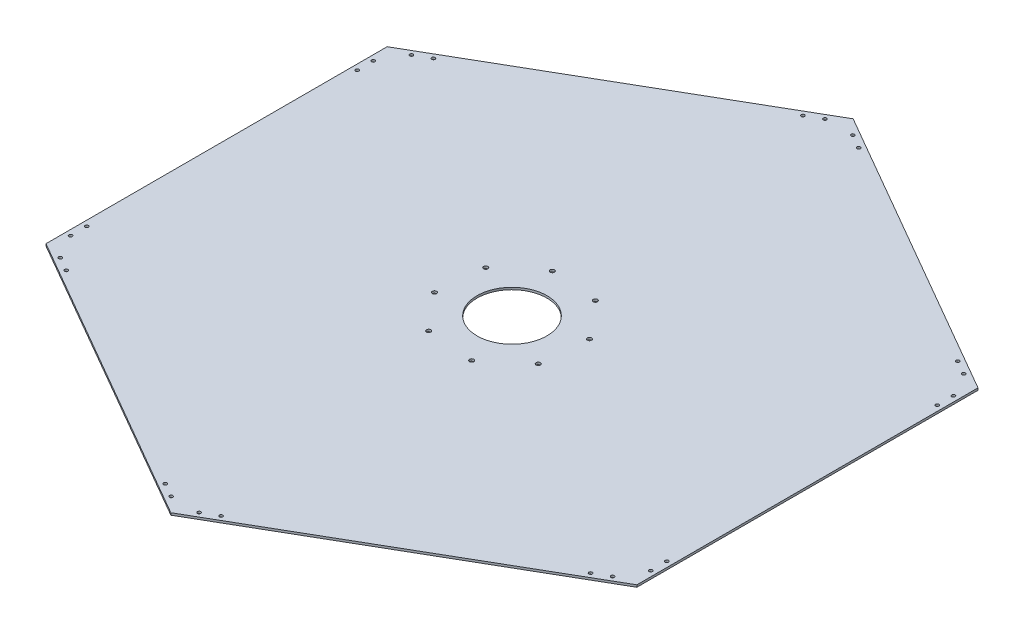
from build123d import *

# Parameters (mm, degrees)
BOSS_EXTRUDE1_DEPTH = 4
CUT_EXTRUDE1_REACH  = 842.148
SKETCH3_R           = 4
CUT_EXTRUDE2_REACH  = 842.148
SKETCH4_R           = 3.1
CIRPATTERN1_COUNT   = 6
CUT_EXTRUDE3_REACH  = 842.148
SKETCH5_R           = 65


with BuildPart() as part:
    # Sketch1 → Boss-Extrude1 (new body)
    with BuildSketch(Plane(origin=(0, 0, 0), x_dir=(1, 0, 0), z_dir=(0, 1, 0))):
        Polygon((0, 635.085296109), (-550, 317.542648054), (-550, -317.542648054), (0, -635.085296109), (550, -317.542648054), (550, 317.542648054), align=None)
    extrude(amount=BOSS_EXTRUDE1_DEPTH)

    # Sketch3 → Cut-Extrude1 (cut, up to next)
    with BuildSketch(Plane(origin=(0, 4, 0), x_dir=(1, 0, 0), z_dir=(0, 1, 0)), mode=Mode.PRIVATE) as cut_extrude1_sk1:
        with Locations(Location((53.101090522, 102.006245815, 0), (0, 0, 270))):
            Circle(SKETCH3_R)
    cut_extrude1_tool1 = extrude(cut_extrude1_sk1.sketch, amount=-CUT_EXTRUDE1_REACH, mode=Mode.PRIVATE) & part.part
    # Sketch3 → Cut-Extrude1 (cut, up to next)
    with BuildSketch(Plane(origin=(0, 4, 0), x_dir=(1, 0, 0), z_dir=(0, 1, 0)), mode=Mode.PRIVATE) as cut_extrude1_sk2:
        with Locations(Location((109.677449336, 34.581166943, 0), (0, 0, 270))):
            Circle(SKETCH3_R)
    cut_extrude1_tool2 = extrude(cut_extrude1_sk2.sketch, amount=-CUT_EXTRUDE1_REACH, mode=Mode.PRIVATE) & part.part
    # Sketch3 → Cut-Extrude1 (cut, up to next)
    with BuildSketch(Plane(origin=(0, 4, 0), x_dir=(1, 0, 0), z_dir=(0, 1, 0)), mode=Mode.PRIVATE) as cut_extrude1_sk3:
        with Locations(Location((102.006245815, -53.101090522, 0), (0, 0, 270))):
            Circle(SKETCH3_R)
    cut_extrude1_tool3 = extrude(cut_extrude1_sk3.sketch, amount=-CUT_EXTRUDE1_REACH, mode=Mode.PRIVATE) & part.part
    # Sketch3 → Cut-Extrude1 (cut, up to next)
    with BuildSketch(Plane(origin=(0, 4, 0), x_dir=(1, 0, 0), z_dir=(0, 1, 0)), mode=Mode.PRIVATE) as cut_extrude1_sk4:
        with Locations(Location((34.581166943, -109.677449336, 0), (0, 0, 270))):
            Circle(SKETCH3_R)
    cut_extrude1_tool4 = extrude(cut_extrude1_sk4.sketch, amount=-CUT_EXTRUDE1_REACH, mode=Mode.PRIVATE) & part.part
    # Sketch3 → Cut-Extrude1 (cut, up to next)
    with BuildSketch(Plane(origin=(0, 4, 0), x_dir=(1, 0, 0), z_dir=(0, 1, 0)), mode=Mode.PRIVATE) as cut_extrude1_sk5:
        with Locations(Location((-53.101090522, -102.006245815, 0), (0, 0, 270))):
            Circle(SKETCH3_R)
    cut_extrude1_tool5 = extrude(cut_extrude1_sk5.sketch, amount=-CUT_EXTRUDE1_REACH, mode=Mode.PRIVATE) & part.part
    # Sketch3 → Cut-Extrude1 (cut, up to next)
    with BuildSketch(Plane(origin=(0, 4, 0), x_dir=(1, 0, 0), z_dir=(0, 1, 0)), mode=Mode.PRIVATE) as cut_extrude1_sk6:
        with Locations(Location((-109.677449336, -34.581166943, 0), (0, 0, 270))):
            Circle(SKETCH3_R)
    cut_extrude1_tool6 = extrude(cut_extrude1_sk6.sketch, amount=-CUT_EXTRUDE1_REACH, mode=Mode.PRIVATE) & part.part
    # Sketch3 → Cut-Extrude1 (cut, up to next)
    with BuildSketch(Plane(origin=(0, 4, 0), x_dir=(1, 0, 0), z_dir=(0, 1, 0)), mode=Mode.PRIVATE) as cut_extrude1_sk7:
        with Locations(Location((-102.006245815, 53.101090522, 0), (0, 0, 270))):
            Circle(SKETCH3_R)
    cut_extrude1_tool7 = extrude(cut_extrude1_sk7.sketch, amount=-CUT_EXTRUDE1_REACH, mode=Mode.PRIVATE) & part.part
    # Sketch3 → Cut-Extrude1 (cut, up to next)
    with BuildSketch(Plane(origin=(0, 4, 0), x_dir=(1, 0, 0), z_dir=(0, 1, 0)), mode=Mode.PRIVATE) as cut_extrude1_sk8:
        with Locations(Location((-34.581166943, 109.677449336, 0), (0, 0, 270))):
            Circle(SKETCH3_R)
    cut_extrude1_tool8 = extrude(cut_extrude1_sk8.sketch, amount=-CUT_EXTRUDE1_REACH, mode=Mode.PRIVATE) & part.part
    add(cut_extrude1_tool1.solids().sort_by_distance((53.101091, 4, -102.006246))[0], mode=Mode.SUBTRACT)
    add(cut_extrude1_tool2.solids().sort_by_distance((109.677449, 4, -34.581167))[0], mode=Mode.SUBTRACT)
    add(cut_extrude1_tool3.solids().sort_by_distance((102.006246, 4, 53.101091))[0], mode=Mode.SUBTRACT)
    add(cut_extrude1_tool4.solids().sort_by_distance((34.581167, 4, 109.677449))[0], mode=Mode.SUBTRACT)
    add(cut_extrude1_tool5.solids().sort_by_distance((-53.101091, 4, 102.006246))[0], mode=Mode.SUBTRACT)
    add(cut_extrude1_tool6.solids().sort_by_distance((-109.677449, 4, 34.581167))[0], mode=Mode.SUBTRACT)
    add(cut_extrude1_tool7.solids().sort_by_distance((-102.006246, 4, -53.101091))[0], mode=Mode.SUBTRACT)
    add(cut_extrude1_tool8.solids().sort_by_distance((-34.581167, 4, -109.677449))[0], mode=Mode.SUBTRACT)

    # Sketch4 → Cut-Extrude2 (cut, up to next)
    with BuildSketch(Plane(origin=(0, 4, 0), x_dir=(1, 0, 0), z_dir=(0, 1, 0)), mode=Mode.PRIVATE) as cut_extrude2_sk1:
        with Locations(Location((25.980762114, 608.538290725, 0), (0, 0, 270))):
            Circle(SKETCH4_R)
    cut_extrude2_tool1 = extrude(cut_extrude2_sk1.sketch, amount=-CUT_EXTRUDE2_REACH, mode=Mode.PRIVATE) & part.part
    # Sketch4 → Cut-Extrude2 (cut, up to next)
    with BuildSketch(Plane(origin=(0, 4, 0), x_dir=(1, 0, 0), z_dir=(0, 1, 0)), mode=Mode.PRIVATE) as cut_extrude2_sk2:
        with Locations(Location((51.961524227, 593.538290725, 0), (0, 0, 270))):
            Circle(SKETCH4_R)
    cut_extrude2_tool2 = extrude(cut_extrude2_sk2.sketch, amount=-CUT_EXTRUDE2_REACH, mode=Mode.PRIVATE) & part.part
    # Sketch4 → Cut-Extrude2 (cut, up to next)
    with BuildSketch(Plane(origin=(0, 4, 0), x_dir=(1, 0, 0), z_dir=(0, 1, 0)), mode=Mode.PRIVATE) as cut_extrude2_sk3:
        with Locations(Location((-51.961524227, 593.538290725, 0), (0, 0, 270))):
            Circle(SKETCH4_R)
    cut_extrude2_tool3 = extrude(cut_extrude2_sk3.sketch, amount=-CUT_EXTRUDE2_REACH, mode=Mode.PRIVATE) & part.part
    # Sketch4 → Cut-Extrude2 (cut, up to next)
    with BuildSketch(Plane(origin=(0, 4, 0), x_dir=(1, 0, 0), z_dir=(0, 1, 0)), mode=Mode.PRIVATE) as cut_extrude2_sk4:
        with Locations(Location((-25.980762114, 608.538290725, 0), (0, 0, 270))):
            Circle(SKETCH4_R)
    cut_extrude2_tool4 = extrude(cut_extrude2_sk4.sketch, amount=-CUT_EXTRUDE2_REACH, mode=Mode.PRIVATE) & part.part
    cut_extrude2_1 = cut_extrude2_tool1.solids().sort_by_distance((25.980762, 4, -608.538291))[0]
    add(cut_extrude2_1, mode=Mode.SUBTRACT)
    cut_extrude2_2 = cut_extrude2_tool2.solids().sort_by_distance((51.961524, 4, -593.538291))[0]
    add(cut_extrude2_2, mode=Mode.SUBTRACT)
    cut_extrude2_3 = cut_extrude2_tool3.solids().sort_by_distance((-51.961524, 4, -593.538291))[0]
    add(cut_extrude2_3, mode=Mode.SUBTRACT)
    cut_extrude2_4 = cut_extrude2_tool4.solids().sort_by_distance((-25.980762, 4, -608.538291))[0]
    add(cut_extrude2_4, mode=Mode.SUBTRACT)
    cut_extrude2 = cut_extrude2_1 + cut_extrude2_2 + cut_extrude2_3 + cut_extrude2_4  # Cut-Extrude2 as one shape, for the pattern or mirror that repeats it

    # CirPattern1: Cut-Extrude2 ×6 about axis
    cirpattern1_axis = Axis((0, 0, 0), (0, 1, 0))
    for i in range(1, CIRPATTERN1_COUNT):
        add(cut_extrude2.rotate(cirpattern1_axis, i * 360 / CIRPATTERN1_COUNT), mode=Mode.SUBTRACT)

    # Sketch5 → Cut-Extrude3 (cut, up to next)
    with BuildSketch(Plane(origin=(0, 4, 0), x_dir=(1, 0, 0), z_dir=(0, 1, 0)), mode=Mode.PRIVATE) as cut_extrude3_sk1:
        with Locations(Location((0, 0, 0), (0, 0, 270))):
            Circle(SKETCH5_R)
    cut_extrude3_tool1 = extrude(cut_extrude3_sk1.sketch, amount=-CUT_EXTRUDE3_REACH, mode=Mode.PRIVATE) & part.part
    add(cut_extrude3_tool1.solids().sort_by_distance((0, 4, 0))[0], mode=Mode.SUBTRACT)


solid = part.part
